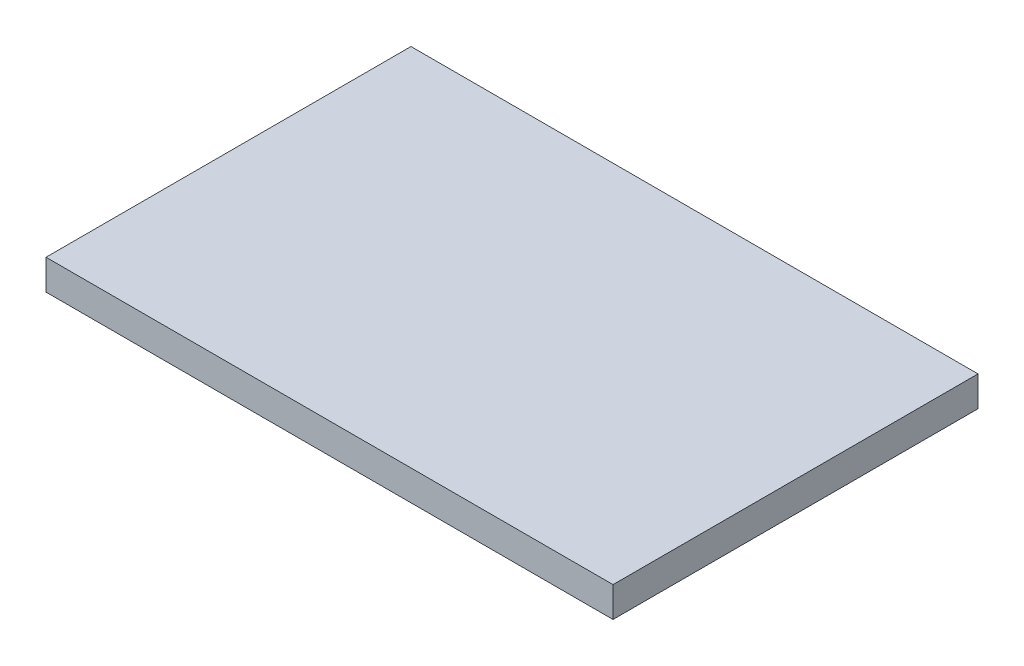
from build123d import *

# Parameters (mm, degrees)
SKETCH1_W           = 47.675026052
SKETCH1_H           = 30.686732224
BOSS_EXTRUDE1_DEPTH = 2.54


with BuildPart() as part:
    # Sketch1 → Boss-Extrude1 (new body)
    with BuildSketch(Plane(origin=(0, 0, 0), x_dir=(1, 0, 0), z_dir=(0, 1, 0))):
        Rectangle(SKETCH1_W, SKETCH1_H)
    extrude(amount=BOSS_EXTRUDE1_DEPTH)


solid = part.part
